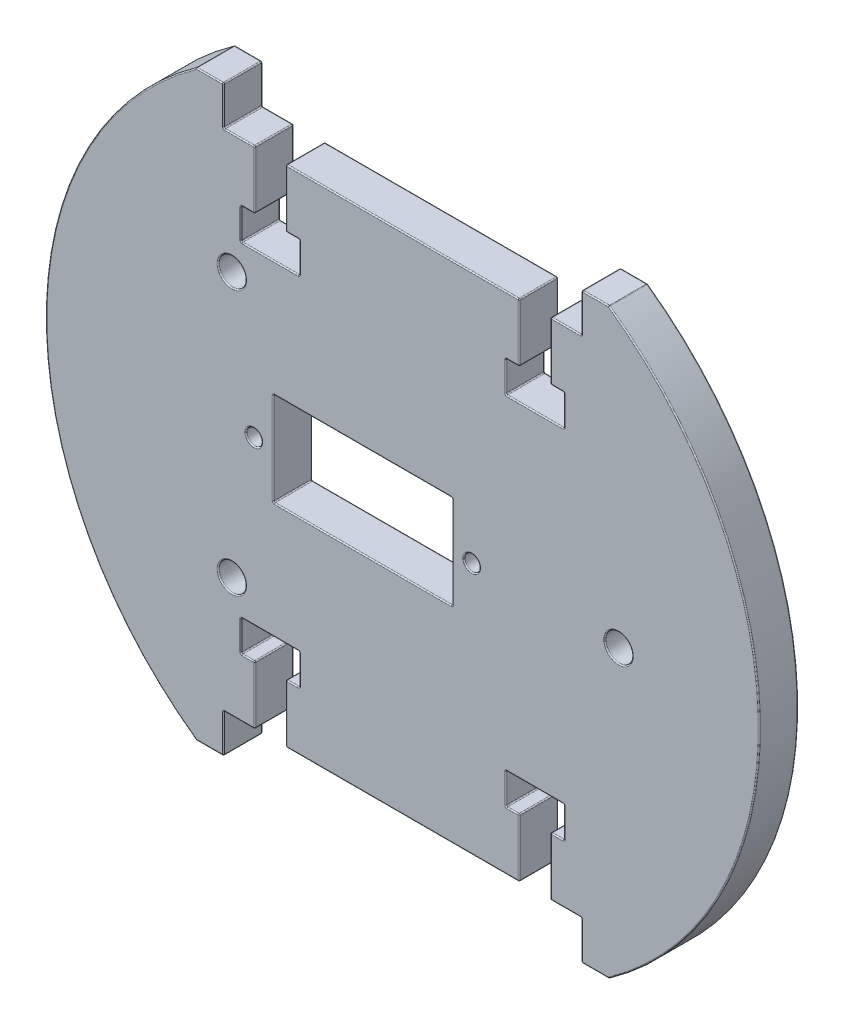
from build123d import *

# Parameters (mm, degrees)
SKETCH1_R           = 1
SKETCH1_R_2         = 1.75
SKETCH1_W           = 23
SKETCH1_H           = 12
BOSS_EXTRUDE1_DEPTH = 5
SKETCH2_W           = 4
SKETCH2_H           = 7.5
SKETCH2_W_2         = 7.5
SKETCH2_H_2         = 4
CUT_EXTRUDE1_DEPTH  = 60.388897917
FILLET2_R           = 0.15


with BuildPart() as part:
    # Sketch1 → Boss-Extrude1 (new body)
    with BuildSketch(Plane.XY):
        with BuildLine():
            Line((-23, 32.415869064), (23, 32.415869064))
            Line((23, 32.415869064), (23, 37.415869064))
            Line((23, 37.415869064), (26.498050496, 37.415869064))
            ThreePointArc((26.498050496, 37.415869064), (45.848597993, 0), (26.498050496, -37.415869064))
            Line((26.498050496, -37.415869064), (23, -37.415869064))
            Line((23, -37.415869064), (23, -32.415869064))
            Line((23, -32.415869064), (-23, -32.415869064))
            Line((-23, -32.415869064), (-23, -37.415869064))
            Line((-23, -37.415869064), (-26.498050496, -37.415869064))
            ThreePointArc((-26.498050496, -37.415869064), (-45.848597993, 0), (-26.498050496, 37.415869064))
            Line((-26.498050496, 37.415869064), (-23, 37.415869064))
            Line((-23, 37.415869064), (-23, 32.415869064))
        make_face()
        with Locations((8.891349281, 0)):
            Circle(SKETCH1_R, mode=Mode.SUBTRACT)
        with Locations((-19.108650719, 0)):
            Circle(SKETCH1_R, mode=Mode.SUBTRACT)
        with Locations((-21.93, 17)):
            Circle(SKETCH1_R_2, mode=Mode.SUBTRACT)
        with Locations((-21.93, -17)):
            Circle(SKETCH1_R_2, mode=Mode.SUBTRACT)
        with Locations((27.75, 0)):
            Circle(SKETCH1_R_2, mode=Mode.SUBTRACT)
        with Locations((-5.108650719, 0)):
            Rectangle(SKETCH1_W, SKETCH1_H, mode=Mode.SUBTRACT)
    extrude(amount=BOSS_EXTRUDE1_DEPTH)

    # Sketch2 → Cut-Extrude1 (cut, through all)
    with BuildSketch(Plane.XY.offset(5)):
        with Locations((-17, 28.665869064)):
            Rectangle(SKETCH2_W, SKETCH2_H)
        Polygon((-15, 24.915869064), (-19, 24.915869064), (-20.75, 24.915869064), (-20.75, 20.915869064), (-13.25, 20.915869064), (-13.25, 24.915869064), align=None)
        with Locations((17, 22.915869064)):
            Rectangle(SKETCH2_W_2, SKETCH2_H_2)
        with Locations((17, 28.665869064)):
            Rectangle(SKETCH2_W, SKETCH2_H)
        Polygon((15, -24.915869064), (19, -24.915869064), (20.75, -24.915869064), (20.75, -20.915869064), (13.25, -20.915869064), (13.25, -24.915869064), align=None)
        with Locations((17, -28.665869064)):
            Rectangle(SKETCH2_W, SKETCH2_H)
        with Locations((-17, -22.915869064)):
            Rectangle(SKETCH2_W_2, SKETCH2_H_2)
        with Locations((-17, -28.665869064)):
            Rectangle(SKETCH2_W, SKETCH2_H)
    extrude(amount=-CUT_EXTRUDE1_DEPTH, mode=Mode.SUBTRACT)

    # Fillet2
    fillet2_edges = [part.edges().sort_by_distance(p)[0] for p in [
        (-17, -20.915869064, 5),
        (-20.75, -20.915869064, 2.5),
        (-13.25, -22.915869064, 5),
        (-13.25, -20.915869064, 2.5),
        (-14.125, -24.915869064, 0),
        (-13.25, -24.915869064, 2.5),
        (-15, -28.665869064, 5),
        (-20.108650719, 0, 5),
        (-15, -24.915869064, 2.5),
        (-15, -32.415869064, 2.5),
        (-19, -28.665869064, 0),
        (-19, -32.415869064, 2.5),
        (-19.875, -24.915869064, 0),
        (-19, -24.915869064, 2.5),
        (-20.75, -22.915869064, 0),
        (-20.75, -24.915869064, 2.5),
        (-17, -20.915869064, 0),
        (-13.25, -22.915869064, 0),
        (-15, -28.665869064, 0),
        (-20.75, -22.915869064, 5),
        (-19.875, -24.915869064, 5),
        (-19, -28.665869064, 5),
        (-14.125, -24.915869064, 5),
        (-21, -32.415869064, 5),
        (-23.68, 17, 5),
        (17, -20.915869064, 0),
        (13.25, -20.915869064, 2.5),
        (26, 0, 5),
        (20.75, -22.915869064, 5),
        (20.75, -20.915869064, 2.5),
        (19.875, -24.915869064, 5),
        (20.75, -24.915869064, 2.5),
        (19, -28.665869064, 5),
        (19, -24.915869064, 2.5),
        (19, -32.415869064, 2.5),
        (15, -28.665869064, 0),
        (15, -32.415869064, 2.5),
        (14.125, -24.915869064, 5),
        (15, -24.915869064, 2.5),
        (13.25, -22.915869064, 0),
        (13.25, -24.915869064, 2.5),
        (20.75, -22.915869064, 0),
        (19.875, -24.915869064, 0),
        (19, -28.665869064, 0),
        (14.125, -24.915869064, 0),
        (17, -20.915869064, 5),
        (13.25, -22.915869064, 5),
        (15, -28.665869064, 5),
        (-23.68, -17, 5),
        (17, 20.915869064, 5),
        (20.75, 20.915869064, 2.5),
        (13.25, 22.915869064, 5),
        (13.25, 20.915869064, 2.5),
        (14.125, 24.915869064, 0),
        (13.25, 24.915869064, 2.5),
        (15, 28.665869064, 5),
        (15, 24.915869064, 2.5),
        (15, 32.415869064, 2.5),
        (19, 28.665869064, 0),
        (19, 32.415869064, 2.5),
        (19.875, 24.915869064, 0),
        (19, 24.915869064, 2.5),
        (20.75, 22.915869064, 0),
        (20.75, 24.915869064, 2.5),
        (17, 20.915869064, 0),
        (13.25, 22.915869064, 0),
        (15, 28.665869064, 0),
        (20.75, 22.915869064, 5),
        (19.875, 24.915869064, 5),
        (19, 28.665869064, 5),
        (14.125, 24.915869064, 5),
        (-19, 28.665869064, 5),
        (-19, 24.915869064, 2.5),
        (-19, 32.415869064, 2.5),
        (-15, 28.665869064, 0),
        (-15, 32.415869064, 2.5),
        (-14.125, 24.915869064, 5),
        (-15, 24.915869064, 2.5),
        (-13.25, 22.915869064, 0),
        (-13.25, 24.915869064, 2.5),
        (-17, 20.915869064, 0),
        (-13.25, 20.915869064, 2.5),
        (-20.75, 22.915869064, 5),
        (-20.75, 20.915869064, 2.5),
        (-19.875, 24.915869064, 5),
        (-20.75, 24.915869064, 2.5),
        (-19, 28.665869064, 0),
        (-14.125, 24.915869064, 0),
        (-20.75, 22.915869064, 0),
        (-19.875, 24.915869064, 0),
        (-17, 20.915869064, 5),
        (-13.25, 22.915869064, 5),
        (-15, 28.665869064, 5),
        (23, -34.915869064, 5),
        (24.749025248, -37.415869064, 5),
        (-23.68, -17, 0),
        (26, 0, 0),
        (-23.68, 17, 0),
        (-20.108650719, 0, 0),
        (45.848597993, 0, 5),
        (7.891349281, 0, 0),
        (-5.108650719, 6, 0),
        (-16.608650719, 0, 0),
        (-5.108650719, -6, 0),
        (6.391349281, 0, 0),
        (-23, -34.915869064, 0),
        (-24.749025248, -37.415869064, 0),
        (-45.848597993, 0, 0),
        (-24.749025248, 37.415869064, 0),
        (-23, 34.915869064, 0),
        (24.749025248, 37.415869064, 5),
        (-21, 32.415869064, 0),
        (23, 34.915869064, 0),
        (24.749025248, 37.415869064, 0),
        (45.848597993, 0, 0),
        (24.749025248, -37.415869064, 0),
        (23, -34.915869064, 0),
        (-21, -32.415869064, 0),
        (23, 34.915869064, 5),
        (6.391349281, 6, 2.5),
        (-16.608650719, 6, 2.5),
        (-16.608650719, -6, 2.5),
        (6.391349281, -6, 2.5),
        (-23, -32.415869064, 2.5),
        (-23, -37.415869064, 2.5),
        (-26.498050496, -37.415869064, 2.5),
        (-26.498050496, 37.415869064, 2.5),
        (-21, 32.415869064, 5),
        (-23, 37.415869064, 2.5),
        (-23, 32.415869064, 2.5),
        (23, 32.415869064, 2.5),
        (23, 37.415869064, 2.5),
        (26.498050496, 37.415869064, 2.5),
        (26.498050496, -37.415869064, 2.5),
        (23, -37.415869064, 2.5),
        (23, -32.415869064, 2.5),
        (-23, 34.915869064, 5),
        (-24.749025248, 37.415869064, 5),
        (-45.848597993, 0, 5),
        (-24.749025248, -37.415869064, 5),
        (0, -32.415869064, 0),
        (21, -32.415869064, 0),
        (0, 32.415869064, 0),
        (-23, -34.915869064, 5),
        (21, 32.415869064, 0),
        (6.391349281, 0, 5),
        (-5.108650719, -6, 5),
        (0, -32.415869064, 5),
        (21, -32.415869064, 5),
        (0, 32.415869064, 5),
        (21, 32.415869064, 5),
        (-16.608650719, 0, 5),
        (-5.108650719, 6, 5),
        (7.891349281, 0, 5),
    ]]
    fillet(fillet2_edges, radius=FILLET2_R)


solid = part.part
